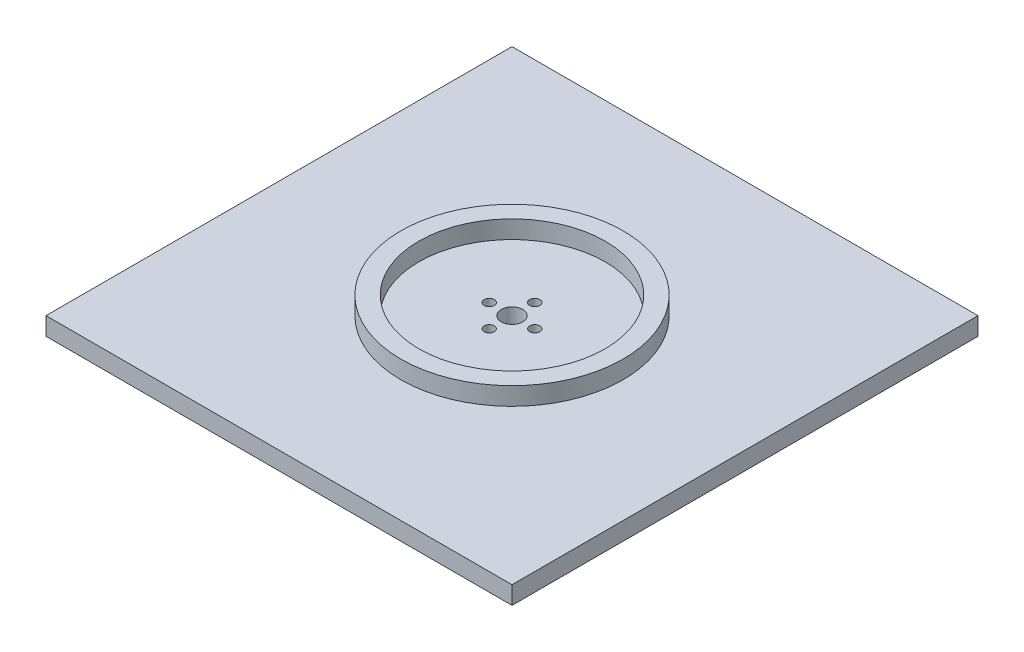
from build123d import *

# Parameters (mm, degrees)
SKETCH1_W           = 130
SKETCH1_H           = 130
SKETCH1_R           = 31
SKETCH1_R_2         = 26
SKETCH1_R_3         = 24
BOSS_EXTRUDE2_DEPTH = 5
SKETCH2_R           = 31
SKETCH2_R_2         = 26
BOSS_EXTRUDE3_DEPTH = 5
SKETCH3_R           = 1.42
SKETCH3_R_2         = 3
CUT_EXTRUDE1_DEPTH  = 5
SKETCH4_R           = 3
CUT_EXTRUDE2_DEPTH  = 3


with BuildPart() as part:
    # Sketch1 → Boss-Extrude2 (new body)
    # profile 1 of 4: a face of its own
    with BuildSketch(Plane(origin=(0, 0, 0), x_dir=(1, 0, 0), z_dir=(0, 1, 0))):
        Rectangle(SKETCH1_W, SKETCH1_H)
        Circle(SKETCH1_R, mode=Mode.SUBTRACT)
    # profile 2 of 4: a face of its own
    with BuildSketch(Plane(origin=(0, 0, 0), x_dir=(1, 0, 0), z_dir=(0, 1, 0))):
        Circle(SKETCH1_R)
        Circle(SKETCH1_R_2, mode=Mode.SUBTRACT)
    # profile 3 of 4: a face of its own
    with BuildSketch(Plane(origin=(0, 0, 0), x_dir=(1, 0, 0), z_dir=(0, 1, 0))):
        Circle(SKETCH1_R_2)
        Circle(SKETCH1_R_3, mode=Mode.SUBTRACT)
    # profile 4 of 4: a face of its own
    with BuildSketch(Plane(origin=(0, 0, 0), x_dir=(1, 0, 0), z_dir=(0, 1, 0))):
        Circle(SKETCH1_R_3)
    extrude(amount=BOSS_EXTRUDE2_DEPTH)

    # Sketch2 → Boss-Extrude3 (add)
    with BuildSketch(Plane(origin=(0, 5, 0), x_dir=(1, 0, 0), z_dir=(0, 1, 0))):
        with Locations(Location((0, 0, 0), (0, 0, 270))):
            Circle(SKETCH2_R)
        with Locations(Location((0, 0, 0), (0, 0, 270))):
            Circle(SKETCH2_R_2, mode=Mode.SUBTRACT)
    extrude(amount=BOSS_EXTRUDE3_DEPTH)

    # Sketch3 → Cut-Extrude1 (cut)
    with BuildSketch(Plane(origin=(0, 5, 0), x_dir=(1, 0, 0), z_dir=(0, 1, 0))):
        with Locations(Location((0, 6.35, 0), (0, 0, 270))):
            Circle(SKETCH3_R)
        with Locations(Location((6.35, 0, 0), (0, 0, 270))):
            Circle(SKETCH3_R)
        with Locations(Location((0, -6.35, 0), (0, 0, 270))):
            Circle(SKETCH3_R)
        with Locations(Location((-6.35, 0, 0), (0, 0, 270))):
            Circle(SKETCH3_R)
        with Locations(Location((0, 0, 0), (0, 0, 270))):
            Circle(SKETCH3_R_2)
    extrude(amount=-CUT_EXTRUDE1_DEPTH, mode=Mode.SUBTRACT)

    # Sketch4 → Cut-Extrude2 (cut)
    with BuildSketch(Plane(origin=(0, 0, 0), x_dir=(-1, 0, 0), z_dir=(0, -1, 0))):
        with Locations(Location((-6.35, 0, 0), (0, 0, 90))):
            Circle(SKETCH4_R)
        with Locations(Location((0, 6.35, 0), (0, 0, 90))):
            Circle(SKETCH4_R)
        with Locations(Location((6.35, 0, 0), (0, 0, 90))):
            Circle(SKETCH4_R)
        with Locations(Location((0, -6.35, 0), (0, 0, 90))):
            Circle(SKETCH4_R)
    extrude(amount=-CUT_EXTRUDE2_DEPTH, mode=Mode.SUBTRACT)


solid = part.part
